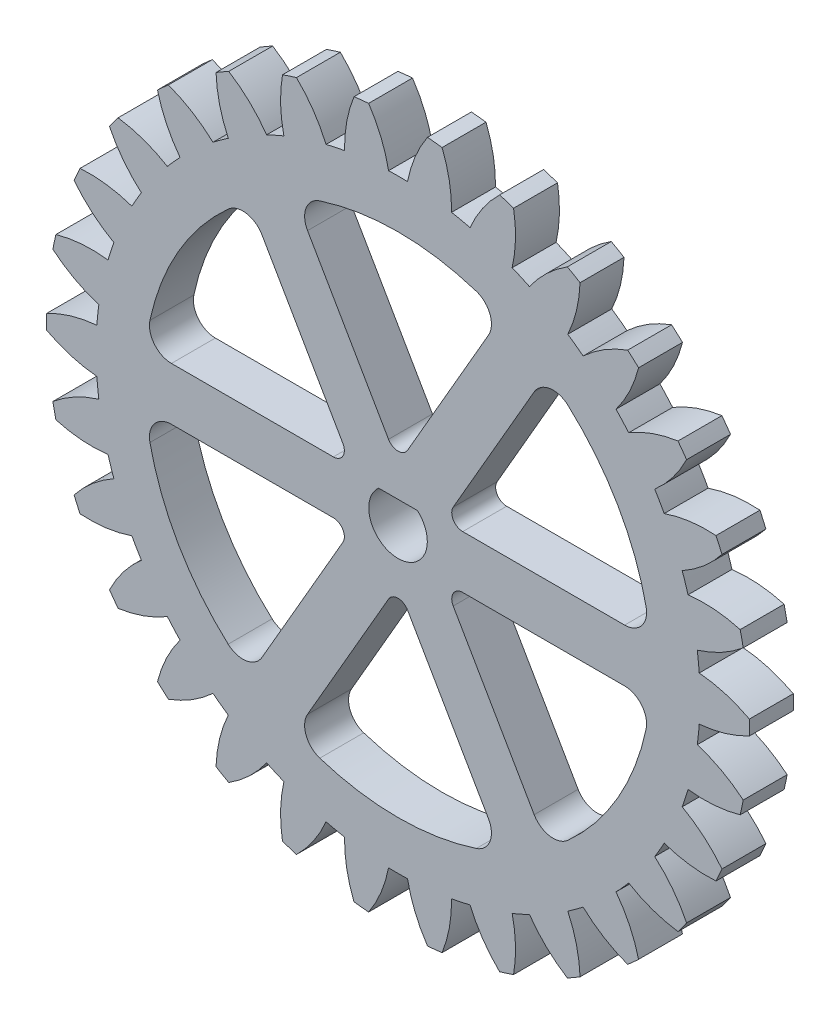
from build123d import *

# Parameters (mm, degrees)
SKETCH1_R           = 24
BOSS_EXTRUDE1_DEPTH = 3
CUT_EXTRUDE1_DEPTH  = 35.073450075
CIRPATTERN1_COUNT   = 30
CUT_EXTRUDE3_DEPTH  = 35.014127378
CIRPATTERN2_COUNT   = 6
CUT_EXTRUDE4_DEPTH  = 35.014127378


with BuildPart() as part:
    # Sketch1 → Boss-Extrude1 (new body)
    with BuildSketch(Plane.XY):
        Circle(SKETCH1_R)
    extrude(amount=BOSS_EXTRUDE1_DEPTH)

    # Sketch2 → Cut-Extrude1 (cut, through all)
    with BuildSketch(Plane.XY.offset(3)):
        with BuildLine():
            ThreePointArc((-2.009760853, 23.915703237), (-1.162767459, 22.333581393), (-0.646511325, 20.614864737))
            ThreePointArc((-0.646511325, 20.614864737), (0, 20.625), (0.646511325, 20.614864737))
            ThreePointArc((0.646511325, 20.614864737), (1.162767459, 22.333581393), (2.009760853, 23.915703237))
            ThreePointArc((2.009760853, 23.915703237), (0, 24), (-2.009760853, 23.915703237))
        make_face()
    cut_extrude1 = extrude(amount=-CUT_EXTRUDE1_DEPTH, mode=Mode.SUBTRACT)

    # CirPattern1: Cut-Extrude1 ×30 about axis
    cirpattern1_axis = Axis((0, 0, 0), (0, 0, 1))
    for i in range(1, CIRPATTERN1_COUNT):
        add(cut_extrude1.rotate(cirpattern1_axis, i * 360 / CIRPATTERN1_COUNT), mode=Mode.SUBTRACT)

    # Sketch3 → Cut-Extrude3 (cut, through all)
    with BuildSketch(Plane.XY.offset(3)):
        with BuildLine():
            Line((-4.416729559, 1.8), (-15.477100019, 1.8))
            ThreePointArc((-15.477100019, 1.8), (-16.643117667, 2.356388404), (-16.944123718, 3.612796209))
            ThreePointArc((-16.944123718, 3.612796209), (-15.003890121, 8.6625), (-11.600835154, 12.86764348))
            ThreePointArc((-11.600835154, 12.86764348), (-10.362251053, 13.235168496), (-9.297395736, 12.503561793))
            Line((-9.297395736, 12.503561793), (-3.767210506, 2.925))
            ThreePointArc((-3.767210506, 2.925), (-3.767210506, 2.175), (-4.416729559, 1.8))
        make_face()
    cut_extrude3 = extrude(amount=-CUT_EXTRUDE3_DEPTH, mode=Mode.SUBTRACT)

    # CirPattern2: Cut-Extrude3 ×6 about axis
    cirpattern2_axis = Axis((0, 0, 0), (0, 0, 1))
    for i in range(1, CIRPATTERN2_COUNT):
        add(cut_extrude3.rotate(cirpattern2_axis, i * 360 / CIRPATTERN2_COUNT), mode=Mode.SUBTRACT)

    # Sketch4 → Cut-Extrude4 (cut, through all)
    with BuildSketch(Plane.XY.offset(3)):
        with BuildLine():
            Line((-1.322875656, 1.5), (1.322875656, 1.5))
            ThreePointArc((1.322875656, 1.5), (0, -2), (-1.322875656, 1.5))
        make_face()
    extrude(amount=-CUT_EXTRUDE4_DEPTH, mode=Mode.SUBTRACT)


solid = part.part
